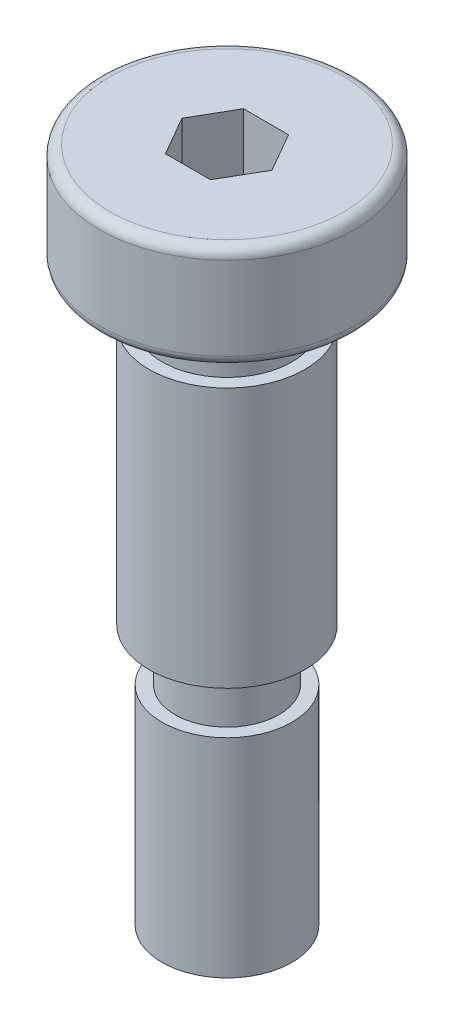
from build123d import *

# Parameters (mm, degrees)
CUT_EXTRUDE_1_DEPTH = 3.5


with BuildPart() as part:
    # 草图1 → 旋转1 (revolve)
    with BuildSketch(Plane.XY, mode=Mode.PRIVATE) as revolve_1_sk:
        with BuildLine():
            Line((0, 26), (-4.5, 26))
            ThreePointArc((-4.5, 26), (-4.782842712, 25.882842712), (-4.9, 25.6))
            Line((-4.9, 25.6), (-4.9, 22.4))
            ThreePointArc((-4.9, 22.4), (-4.782842712, 22.117157288), (-4.5, 22))
            Line((-4.5, 22), (-2.5, 22))
            Line((-2.5, 22), (-2.5, 20))
            Line((-2.5, 20), (-3, 20))
            Line((-3, 20), (-3, 10))
            Line((-3, 10), (-2, 10))
            Line((-2, 10), (-2, 8))
            Line((-2, 8), (-2.5, 8))
            Line((-2.5, 8), (-2.5, 0))
            Line((-2.5, 0), (0, 0))
            Line((0, 0), (0, 26))
        make_face()
    revolve(revolve_1_sk.sketch.rotate(Axis((0, 0, 0), (0, 1, 0)), 270), axis=Axis((0, 0, 0), (0, 1, 0)))

    # 草图2 → 切除-拉伸1 (cut)
    with BuildSketch(Plane(origin=(0, 26, 0), x_dir=(1, 0, 0), z_dir=(0, 1, 0))):
        Polygon((0.866025404, 1.5), (-0.866025404, 1.5), (-1.732050808, 0), (-0.866025404, -1.5), (0.866025404, -1.5), (1.732050808, 0), align=None)
    extrude(amount=-CUT_EXTRUDE_1_DEPTH, mode=Mode.SUBTRACT)


solid = part.part
